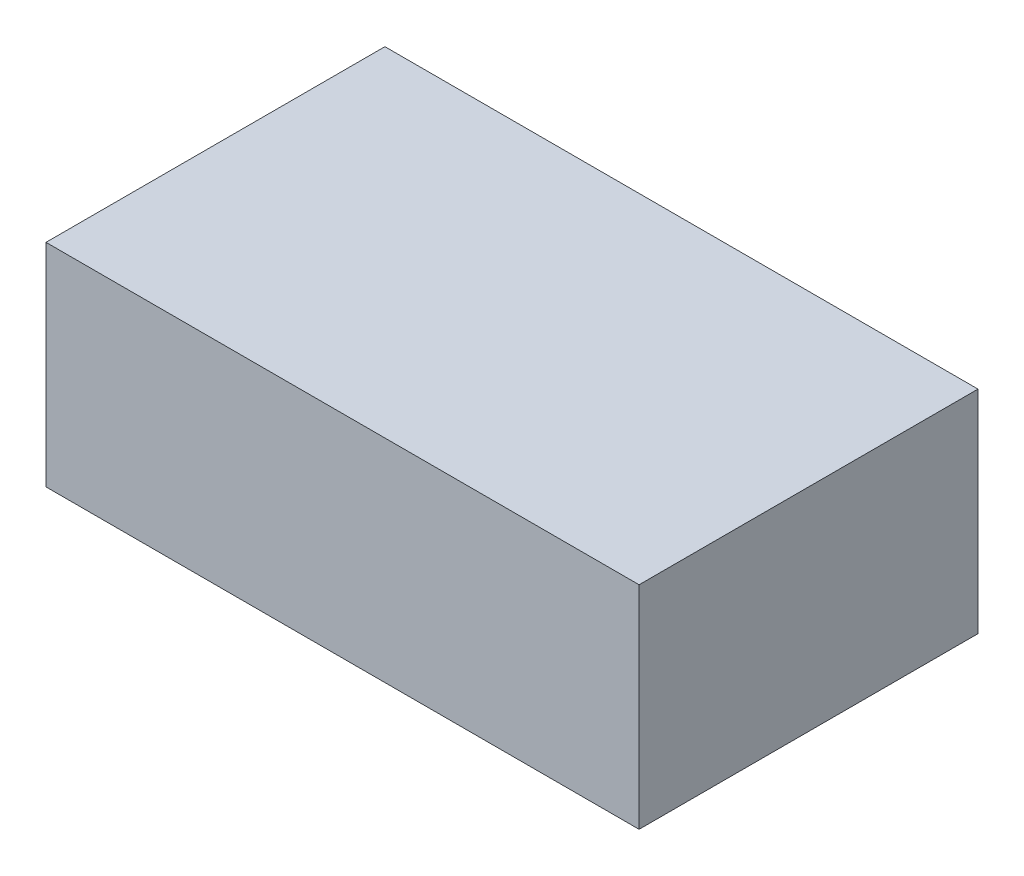
from build123d import *

# Parameters (mm, degrees)
SKETCH_1_W          = 140
SKETCH_1_H          = 50
EXTRUDE_1_DEPTH     = 80
SKETCH_3_W          = 40
SKETCH_3_H          = 40
CUT_EXTRUDE_3_DEPTH = 75


with BuildPart() as part:
    # 草图1 → 凸台-拉伸1 (new body)
    with BuildSketch(Plane.XY):
        with Locations((-29.932659933, 5.892255892)):
            Rectangle(SKETCH_1_W, SKETCH_1_H)
    extrude(amount=EXTRUDE_1_DEPTH)

    # 草图3 → 切除-拉伸3 (cut)
    with BuildSketch(Plane(origin=(0, 0, 0), x_dir=(-1, 0, 0), z_dir=(0, 0, -1))):
        with Locations((29.932659933, 5.892255892)):
            Rectangle(SKETCH_3_W, SKETCH_3_H)
        with Locations((-15.067340067, 5.892255892)):
            Rectangle(SKETCH_3_W, SKETCH_3_H)
        with Locations((74.932659933, 5.892255892)):
            Rectangle(SKETCH_3_W, SKETCH_3_H)
    extrude(amount=-CUT_EXTRUDE_3_DEPTH, mode=Mode.SUBTRACT)


solid = part.part
